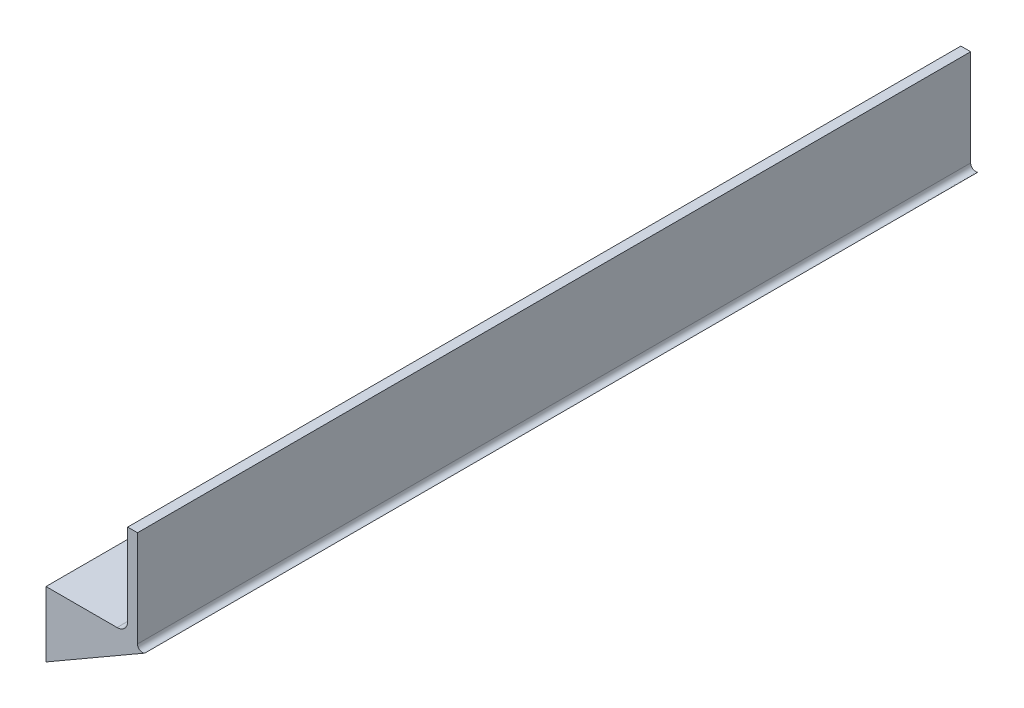
from build123d import *

# Parameters (mm, degrees)
SALIENTE_EXTRUIR1_DEPTH = 255
CROQUIS4_W              = 1.329700855
CROQUIS4_H              = 7.408333333
CROQUIS4_W_2            = 1.329700854
CORTAR_EXTRUIR1_DEPTH   = 1
CROQUIS3_R              = 3
CORTAR_EXTRUIR2_DEPTH   = 4


with BuildPart() as part:
    # Croquis2 → Saliente-Extruir1 (new body)
    with BuildSketch(Plane.XY):
        with BuildLine():
            Line((0, 0), (21.75, 0))
            ThreePointArc((21.75, 0), (24.048097039, 0.951902961), (25, 3.25))
            Line((25, 3.25), (25, 28.25))
            Line((25, 28.25), (28, 28.25))
            Line((28, 28.25), (28, -1.236116251))
            ThreePointArc((28, -1.236116251), (28.75, -2.535154357), (30.25, -2.535154357))
            Line((30.25, -2.535154357), (28, -3.834192463))
            Line((28, -3.834192463), (0, -20))
            Line((0, -20), (0, 0))
        make_face()
    extrude(amount=SALIENTE_EXTRUIR1_DEPTH)

    # Croquis4 → Cortar-Extruir1 (cut)
    # profile 1 of 10: a face of its own
    with BuildSketch(Plane.ZY):
        with BuildLine():
            Line((100.85849359, -13), (100.85849359, -5.591666667))
            Line((100.85849359, -5.591666667), (102.045726496, -5.591666667))
            add(Edge.make_bspline(
                [(102.045726496, -5.591666667), (102.128840223, -5.591657181), (102.289663708, -5.591638827), (102.521690027, -5.59978683), (102.736874843, -5.610327184), (102.934533353, -5.622119389), (103.115001988, -5.642439715), (103.278006314, -5.663855118), (103.423872015, -5.689680775), (103.514052852, -5.712847189), (103.556480369, -5.723746327)],
                knots=[0, 0, 0, 0, 1.311965854, 2.538629056, 3.664479157, 4.713267157, 5.663616078, 6.530575999, 7.308677837, 8, 8, 8, 8], degree=3))
            add(Edge.make_bspline(
                [(103.556480369, -5.723746327), (103.612192006, -5.739119756), (103.721516122, -5.769287359), (103.878103145, -5.830212136), (104.026647779, -5.897934346), (104.166968655, -5.975192721), (104.298204147, -6.062919987), (104.419855516, -6.161812373), (104.534546479, -6.267900344), (104.638204624, -6.38414054), (104.731894509, -6.50696984), (104.81329422, -6.636356059), (104.884020136, -6.770320797), (104.940619395, -6.910549911), (104.983265873, -7.056397608), (105.014457329, -7.207241096), (105.034673616, -7.363557681), (105.03658379, -7.469904963), (105.037553419, -7.523888221)],
                knots=[0, 0, 0, 0, 1.099996261, 2.158545794, 3.195537121, 4.207578794, 5.205712374, 6.197378256, 7.190519799, 8.17788031, 9.159561366, 10.129234751, 11.085776129, 12.040971148, 13.00380137, 13.975669004, 14.972423361, 16, 16, 16, 16], degree=3))
            add(Edge.make_bspline(
                [(105.037553419, -7.523888221), (105.035018127, -7.593242538), (105.030027716, -7.729757989), (104.998148633, -7.930274489), (104.938370385, -8.119791401), (104.860152002, -8.301801453), (104.753799454, -8.475625744), (104.618752288, -8.641181627), (104.457197825, -8.803566814), (104.333276633, -8.900905781), (104.268820112, -8.951535791)],
                knots=[0, 0, 0, 0, 0.986156485, 1.941127874, 2.875419072, 3.804401753, 4.751181392, 5.761612777, 6.835722519, 8, 8, 8, 8], degree=3))
            add(Edge.make_bspline(
                [(104.268820112, -8.951535791), (104.321052585, -8.978200015), (104.423466012, -9.030481181), (104.568862991, -9.116415812), (104.703484723, -9.207818191), (104.82793481, -9.302849265), (104.939602769, -9.405537539), (105.043099558, -9.509965974), (105.133319182, -9.622117885), (105.213996289, -9.737995964), (105.28411952, -9.859278139), (105.345189121, -9.985759592), (105.396772422, -10.117872411), (105.440454496, -10.254944249), (105.473032598, -10.397446568), (105.494274213, -10.545430335), (105.510538122, -10.698390847), (105.511803301, -10.802583729), (105.512446581, -10.855560564)],
                knots=[0, 0, 0, 0, 1.164658916, 2.283573913, 3.35186032, 4.395461096, 5.390182219, 6.362969632, 7.312859996, 8.245001507, 9.165155236, 10.092416118, 11.032087915, 11.979892451, 12.947605196, 13.931445124, 14.948243989, 16, 16, 16, 16], degree=3))
            add(Edge.make_bspline(
                [(105.512446581, -10.855560564), (105.508272124, -10.956743289), (105.50003385, -11.156426991), (105.439799611, -11.449608526), (105.33537258, -11.727571212), (105.195148611, -11.989210308), (105.022365701, -12.226951791), (104.823714904, -12.435211265), (104.601196177, -12.611498287), (104.395895756, -12.730478351), (104.218327059, -12.8103251), (104.071250226, -12.859691396), (103.913292824, -12.905424257), (103.741561454, -12.937538817), (103.55916937, -12.966933593), (103.36433824, -12.985082537), (103.157432198, -12.997381629), (103.015320185, -12.999109564), (102.94208734, -13)],
                knots=[0, 0, 0, 0, 1.284142165, 2.534249414, 3.780121997, 5.041676246, 6.291546858, 7.49970053, 8.684500223, 9.883330709, 10.50184324, 11.153274765, 11.851151195, 12.587658647, 13.369265475, 14.195992086, 15.070362669, 16, 16, 16, 16], degree=3))
            Line((102.94208734, -13), (100.85849359, -13))
        make_face()
        with BuildLine():
            Line((102.188194444, -6.921367521), (102.188194444, -8.536004274))
            Line((102.188194444, -8.536004274), (102.541396234, -8.536004274))
            add(Edge.make_bspline(
                [(102.541396234, -8.536004274), (102.589399531, -8.535585667), (102.682066989, -8.534777571), (102.815915304, -8.524369584), (102.940372622, -8.506612912), (103.054966901, -8.481837888), (103.160765631, -8.450377219), (103.257092937, -8.412523259), (103.343525287, -8.366337313), (103.443939687, -8.297541309), (103.550084949, -8.196304908), (103.643523429, -8.050047952), (103.69855807, -7.88185301), (103.704687444, -7.763228913), (103.707852564, -7.701973157)],
                knots=[0, 0, 0, 0, 1.065314748, 2.056525647, 2.977365736, 3.853934255, 4.656397591, 5.425096493, 6.14721249, 6.826394842, 8.123232004, 9.372140726, 10.643011755, 12, 12, 12, 12], degree=3))
            add(Edge.make_bspline(
                [(103.707852564, -7.701973157), (103.705319889, -7.644596964), (103.700423063, -7.533662402), (103.645010256, -7.377900396), (103.558943211, -7.23986338), (103.457328967, -7.145388332), (103.361639411, -7.080864659), (103.279704142, -7.038378568), (103.189774031, -7.000345453), (103.090108128, -6.971264407), (102.98127558, -6.949443014), (102.863805048, -6.933417814), (102.737493853, -6.922510381), (102.650250443, -6.921756646), (102.605210003, -6.921367521)],
                knots=[0, 0, 0, 0, 1.347982417, 2.606269829, 3.849316587, 5.153353503, 5.842674298, 6.568177932, 7.326619318, 8.142485038, 9.012069166, 9.942760135, 10.937925643, 12, 12, 12, 12], degree=3))
            Line((102.605210003, -6.921367521), (102.188194444, -6.921367521))
        make_face(mode=Mode.SUBTRACT)
        with BuildLine():
            Line((102.188194444, -9.770726496), (102.188194444, -11.670299145))
            Line((102.188194444, -11.670299145), (102.571077057, -11.670299145))
            add(Edge.make_bspline(
                [(102.571077057, -11.670299145), (102.646773437, -11.669866695), (102.792309173, -11.669035254), (103.000788857, -11.658989479), (103.19034901, -11.640883739), (103.360487368, -11.618280181), (103.511464532, -11.587655895), (103.642770161, -11.54872104), (103.756204943, -11.505885918), (103.851088717, -11.452979457), (103.928603325, -11.391409456), (103.998552131, -11.328483436), (104.055584029, -11.255892327), (104.100708731, -11.176752263), (104.139764081, -11.093029143), (104.16331951, -11.001453606), (104.181253787, -10.904739734), (104.182240758, -10.83784484), (104.182745726, -10.803619124)],
                knots=[0, 0, 0, 0, 1.753078804, 3.370512758, 4.83203934, 6.162291463, 7.344201807, 8.395507345, 9.331626367, 10.147333109, 10.898971645, 11.62040215, 12.321813352, 13.025280112, 13.727906689, 14.453419512, 15.208716525, 16, 16, 16, 16], degree=3))
            add(Edge.make_bspline(
                [(104.182745726, -10.803619124), (104.181632127, -10.76448148), (104.179463133, -10.688251877), (104.161748941, -10.576834177), (104.129556466, -10.472818362), (104.089008472, -10.373544607), (104.032583786, -10.282567258), (103.965524974, -10.196737933), (103.88450081, -10.118963079), (103.793384411, -10.044538582), (103.687106153, -9.979375903), (103.565616173, -9.922835737), (103.428254471, -9.875615472), (103.274595554, -9.838018666), (103.105313053, -9.806110777), (102.919171389, -9.787058244), (102.717720816, -9.772888039), (102.578031711, -9.771463382), (102.505779247, -9.770726496)],
                knots=[0, 0, 0, 0, 0.845221588, 1.646264278, 2.427170338, 3.19324141, 3.95557735, 4.731569926, 5.540061037, 6.376114724, 7.268642756, 8.224665384, 9.265483498, 10.400594375, 11.639216012, 12.983232105, 14.439614077, 16, 16, 16, 16], degree=3))
            Line((102.505779247, -9.770726496), (102.188194444, -9.770726496))
        make_face(mode=Mode.SUBTRACT)
    # profile 2 of 10: a face of its own
    with BuildSketch(Plane.ZY):
        with Locations((107.317040599, -9.295833333)):
            Rectangle(CROQUIS4_W, CROQUIS4_H)
    # profile 3 of 10: a face of its own
    with BuildSketch(Plane.ZY):
        with BuildLine():
            add(Edge.make_bspline(
                [(113.173066907, -5.401709402), (113.301869861, -5.405044341), (113.556156067, -5.411628266), (113.930119312, -5.466510421), (114.290502045, -5.555933025), (114.637141301, -5.680236913), (114.969169134, -5.842788864), (115.28775672, -6.038980426), (115.591762891, -6.272514595), (115.878072437, -6.537943406), (116.142674094, -6.826585648), (116.371951585, -7.137360338), (116.567471018, -7.462214992), (116.729518047, -7.802020066), (116.852947021, -8.159128874), (116.939562238, -8.531720633), (116.995208223, -8.919689343), (117.001608368, -9.183843154), (117.004861111, -9.31809395)],
                knots=[0, 0, 0, 0, 1.014329547, 2.002516266, 2.970391464, 3.935626869, 4.897733899, 5.877609409, 6.878433252, 7.912639331, 8.949961323, 9.958554974, 10.949718813, 11.932905612, 12.9188844, 13.919928257, 14.942845884, 16, 16, 16, 16], degree=3))
            add(Edge.make_bspline(
                [(117.004861111, -9.31809395), (117.00139708, -9.450832051), (116.994571097, -9.712396736), (116.941833951, -10.096790161), (116.853760123, -10.465390686), (116.732424601, -10.819032645), (116.573316492, -11.156003118), (116.381609901, -11.478453615), (116.152246055, -11.783391718), (115.893590755, -12.070653786), (115.608833716, -12.331405752), (115.307230808, -12.561192972), (114.990174645, -12.755905991), (114.658129297, -12.91545562), (114.31038271, -13.039276211), (113.947793858, -13.126640636), (113.57038518, -13.17973376), (113.313728976, -13.186515157), (113.183455195, -13.189957265)],
                knots=[0, 0, 0, 0, 1.051557043, 2.072126891, 3.067553643, 4.050577992, 5.02905126, 6.015227836, 7.017913613, 8.04756643, 9.074058332, 10.072836633, 11.047628519, 12.017157415, 12.98668631, 13.966869689, 14.968021931, 16, 16, 16, 16], degree=3))
            add(Edge.make_bspline(
                [(113.183455195, -13.189957265), (113.04720444, -13.186869525), (112.779490331, -13.180802538), (112.387689534, -13.12310826), (112.012310516, -13.036200522), (111.656506677, -12.906495387), (111.316654459, -12.744353061), (110.995250856, -12.544665066), (110.69240388, -12.307761401), (110.409850712, -12.039709257), (110.153856858, -11.746401419), (109.927892068, -11.436547699), (109.737285755, -11.112515106), (109.582030946, -10.774151986), (109.45963429, -10.423561183), (109.373297357, -10.058607499), (109.32229607, -9.680166225), (109.315191887, -9.423121347), (109.31159188, -9.292865251)],
                knots=[0, 0, 0, 0, 1.067978421, 2.098431617, 3.099715153, 4.085208694, 5.062210972, 6.048429807, 7.046490867, 8.072918869, 9.098532598, 10.095778865, 11.076610158, 12.041847152, 13.011192615, 13.984257998, 14.978533688, 16, 16, 16, 16], degree=3))
            add(Edge.make_bspline(
                [(109.31159188, -9.292865251), (109.31272177, -9.205235769), (109.314967241, -9.031086394), (109.342016313, -8.77300591), (109.3809592, -8.519962811), (109.438553881, -8.272965982), (109.508516699, -8.030272977), (109.599163412, -7.794142842), (109.702343903, -7.562053058), (109.822900591, -7.336744895), (109.956947972, -7.120291377), (110.103205599, -6.913713554), (110.262041235, -6.719509252), (110.432943218, -6.536402241), (110.616500499, -6.365596098), (110.810298572, -6.204672822), (111.018095991, -6.057907109), (111.235344722, -5.921714647), (111.460819968, -5.798558166), (111.693603838, -5.693731052), (111.928900527, -5.60218732), (112.169853279, -5.529936958), (112.413879859, -5.471089794), (112.663587195, -5.432173155), (112.916719323, -5.405124832), (113.087414924, -5.40285058), (113.173066907, -5.401709402)],
                knots=[0, 0, 0, 0, 1.034744296, 2.056386356, 3.06226378, 4.057406941, 5.050368692, 6.043467995, 7.042652155, 8.049140477, 9.059438543, 10.048523776, 11.036952808, 12.020949711, 13.004946614, 13.997082645, 14.994316842, 16.007702937, 17.024872941, 18.026463647, 19.021641123, 20.005082605, 20.995858141, 21.984425357, 22.988620895, 24, 24, 24, 24], degree=3))
        make_face()
        with BuildLine():
            add(Edge.make_bspline(
                [(113.152290331, -6.731410256), (113.06560596, -6.733736193), (112.894525699, -6.73832666), (112.643582113, -6.773299814), (112.402667408, -6.829155916), (112.17311707, -6.910062797), (111.953936207, -7.013036722), (111.744736281, -7.137717888), (111.548414277, -7.28839207), (111.362352431, -7.456970244), (111.19427617, -7.644805071), (111.045775491, -7.846102034), (110.921504342, -8.060524968), (110.817426476, -8.286081936), (110.73907891, -8.525309267), (110.683274287, -8.776333066), (110.648007849, -9.03958586), (110.643562471, -9.219044948), (110.641292735, -9.310673745)],
                knots=[0, 0, 0, 0, 1.033739768, 2.040188636, 3.016340934, 3.979330865, 4.937572243, 5.900995986, 6.878200029, 7.884839167, 8.891893314, 9.879764717, 10.863503415, 11.843163062, 12.837761627, 13.859916423, 14.907309254, 16, 16, 16, 16], degree=3))
            add(Edge.make_bspline(
                [(110.641292735, -9.310673745), (110.644302058, -9.412219063), (110.650199832, -9.611231063), (110.691697288, -9.901544406), (110.762695305, -10.175716545), (110.86521506, -10.432406545), (110.992366453, -10.674464756), (111.150268304, -10.898924411), (111.336363348, -11.107129469), (111.479729463, -11.228688254), (111.55249399, -11.290384615)],
                knots=[0, 0, 0, 0, 1.078454662, 2.113592447, 3.107694534, 4.079536787, 5.043276885, 6.005368276, 6.987637804, 8, 8, 8, 8], degree=3))
            add(Edge.make_bspline(
                [(111.55249399, -11.290384615), (111.61210203, -11.335963517), (111.72997513, -11.42609442), (111.91812626, -11.541615663), (112.111884876, -11.640628892), (112.312713128, -11.720630409), (112.520186879, -11.783558258), (112.734277676, -11.827625596), (112.954682172, -11.855281661), (113.103730021, -11.858587085), (113.179003072, -11.86025641)],
                knots=[0, 0, 0, 0, 1.023928204, 2.024787132, 3.009472467, 3.9914905, 4.972207045, 5.96565515, 6.972602802, 8, 8, 8, 8], degree=3))
            add(Edge.make_bspline(
                [(113.179003072, -11.86025641), (113.264196903, -11.857910753), (113.431818446, -11.853295597), (113.678090581, -11.818752982), (113.914026768, -11.760294406), (114.141091716, -11.680097269), (114.358630672, -11.575830417), (114.565580464, -11.447282032), (114.762303932, -11.296030524), (114.948128737, -11.125238549), (115.117981393, -10.936663782), (115.266172182, -10.734293123), (115.394394533, -10.522585402), (115.496308098, -10.298544219), (115.577751, -10.064284416), (115.632883984, -9.818768507), (115.668448344, -9.563008603), (115.672894975, -9.38895495), (115.675160256, -9.300285457)],
                knots=[0, 0, 0, 0, 1.026359118, 2.019393844, 2.989460624, 3.950973911, 4.916101784, 5.890408035, 6.881132271, 7.902007068, 8.92769091, 9.933912415, 10.920395702, 11.90457117, 12.894218921, 13.903490204, 14.931958862, 16, 16, 16, 16], degree=3))
            add(Edge.make_bspline(
                [(115.675160256, -9.300285457), (115.672816596, -9.212125837), (115.668203458, -9.038597072), (115.633600046, -8.783494725), (115.575512198, -8.539062697), (115.495074238, -8.304901805), (115.392359222, -8.080782485), (115.265341684, -7.867492873), (115.114467313, -7.665239167), (114.943208474, -7.475399649), (114.756803754, -7.300949292), (114.556679661, -7.149558094), (114.348435893, -7.018003957), (114.127294321, -6.914949757), (113.897779317, -6.832846696), (113.658490368, -6.772384823), (113.408521152, -6.738572348), (113.238461927, -6.733818901), (113.152290331, -6.731410256)],
                knots=[0, 0, 0, 0, 1.055025985, 2.07665775, 3.074803781, 4.057872707, 5.035505728, 6.020516407, 7.023567878, 8.050795229, 9.077271434, 10.074415901, 11.050397877, 12.019801805, 12.988065821, 13.964604439, 14.968634123, 16, 16, 16, 16], degree=3))
        make_face(mode=Mode.SUBTRACT)
    # profile 4 of 10: a face of its own
    with BuildSketch(Plane.ZY):
        with BuildLine():
            Line((118.334561966, -13), (118.334561966, -5.591666667))
            Line((118.334561966, -5.591666667), (119.521794872, -5.591666667))
            add(Edge.make_bspline(
                [(119.521794872, -5.591666667), (119.604908599, -5.591657181), (119.765732084, -5.591638827), (119.997758403, -5.59978683), (120.212943219, -5.610327184), (120.410601729, -5.622119389), (120.591070364, -5.642439715), (120.75407469, -5.663855118), (120.899940391, -5.689680775), (120.990121228, -5.712847189), (121.032548745, -5.723746327)],
                knots=[0, 0, 0, 0, 1.311965854, 2.538629056, 3.664479157, 4.713267157, 5.663616078, 6.530575999, 7.308677837, 8, 8, 8, 8], degree=3))
            add(Edge.make_bspline(
                [(121.032548745, -5.723746327), (121.088260382, -5.739119756), (121.197584498, -5.769287359), (121.354171521, -5.830212136), (121.502716155, -5.897934346), (121.643037031, -5.975192721), (121.774272523, -6.062919987), (121.895923892, -6.161812373), (122.010614856, -6.267900344), (122.114273001, -6.38414054), (122.207962885, -6.50696984), (122.289362596, -6.636356059), (122.360088512, -6.770320797), (122.416687771, -6.910549911), (122.459334249, -7.056397608), (122.490525705, -7.207241096), (122.510741992, -7.363557681), (122.512652166, -7.469904963), (122.513621795, -7.523888221)],
                knots=[0, 0, 0, 0, 1.099996261, 2.158545794, 3.195537121, 4.207578794, 5.205712374, 6.197378256, 7.190519799, 8.17788031, 9.159561366, 10.129234751, 11.085776129, 12.040971148, 13.00380137, 13.975669004, 14.972423361, 16, 16, 16, 16], degree=3))
            add(Edge.make_bspline(
                [(122.513621795, -7.523888221), (122.511086503, -7.593242538), (122.506096092, -7.729757989), (122.474217009, -7.930274489), (122.414438761, -8.119791401), (122.336220378, -8.301801453), (122.22986783, -8.475625744), (122.094820664, -8.641181627), (121.933266201, -8.803566814), (121.809345009, -8.900905781), (121.744888488, -8.951535791)],
                knots=[0, 0, 0, 0, 0.986156485, 1.941127874, 2.875419072, 3.804401753, 4.751181392, 5.761612777, 6.835722519, 8, 8, 8, 8], degree=3))
            add(Edge.make_bspline(
                [(121.744888488, -8.951535791), (121.797120961, -8.978200015), (121.899534388, -9.030481181), (122.044931367, -9.116415812), (122.179553099, -9.207818191), (122.304003186, -9.302849265), (122.415671145, -9.405537539), (122.519167934, -9.509965974), (122.609387558, -9.622117885), (122.690064665, -9.737995964), (122.760187896, -9.859278139), (122.821257497, -9.985759592), (122.872840798, -10.117872411), (122.916522872, -10.254944249), (122.949100974, -10.397446568), (122.97034259, -10.545430335), (122.986606498, -10.698390847), (122.987871677, -10.802583729), (122.988514957, -10.855560564)],
                knots=[0, 0, 0, 0, 1.164658916, 2.283573913, 3.35186032, 4.395461096, 5.390182219, 6.362969632, 7.312859996, 8.245001507, 9.165155236, 10.092416118, 11.032087915, 11.979892451, 12.947605196, 13.931445124, 14.948243989, 16, 16, 16, 16], degree=3))
            add(Edge.make_bspline(
                [(122.988514957, -10.855560564), (122.9843405, -10.956743289), (122.976102226, -11.156426991), (122.915867987, -11.449608526), (122.811440956, -11.727571212), (122.671216987, -11.989210308), (122.498434078, -12.226951791), (122.29978328, -12.435211265), (122.077264553, -12.611498287), (121.871964132, -12.730478351), (121.694395435, -12.8103251), (121.547318602, -12.859691396), (121.3893612, -12.905424257), (121.21762983, -12.937538817), (121.035237747, -12.966933593), (120.840406616, -12.985082537), (120.633500575, -12.997381629), (120.491388561, -12.999109564), (120.418155716, -13)],
                knots=[0, 0, 0, 0, 1.284142165, 2.534249414, 3.780121997, 5.041676246, 6.291546858, 7.49970053, 8.684500223, 9.883330709, 10.50184324, 11.153274765, 11.851151195, 12.587658647, 13.369265475, 14.195992086, 15.070362669, 16, 16, 16, 16], degree=3))
            Line((120.418155716, -13), (118.334561966, -13))
        make_face()
        with BuildLine():
            Line((119.664262821, -6.921367521), (119.664262821, -8.536004274))
            Line((119.664262821, -8.536004274), (120.01746461, -8.536004274))
            add(Edge.make_bspline(
                [(120.01746461, -8.536004274), (120.065467907, -8.535585667), (120.158135365, -8.534777571), (120.29198368, -8.524369584), (120.416440998, -8.506612912), (120.531035277, -8.481837888), (120.636834007, -8.450377219), (120.733161313, -8.412523259), (120.819593663, -8.366337313), (120.920008063, -8.297541309), (121.026153325, -8.196304908), (121.119591805, -8.050047952), (121.174626446, -7.88185301), (121.18075582, -7.763228913), (121.18392094, -7.701973157)],
                knots=[0, 0, 0, 0, 1.065314748, 2.056525647, 2.977365736, 3.853934255, 4.656397591, 5.425096493, 6.14721249, 6.826394842, 8.123232004, 9.372140726, 10.643011755, 12, 12, 12, 12], degree=3))
            add(Edge.make_bspline(
                [(121.18392094, -7.701973157), (121.181388265, -7.644596964), (121.176491439, -7.533662402), (121.121078632, -7.377900396), (121.035011587, -7.23986338), (120.933397343, -7.145388332), (120.837707787, -7.080864659), (120.755772518, -7.038378568), (120.665842407, -7.000345453), (120.566176504, -6.971264407), (120.457343956, -6.949443014), (120.339873424, -6.933417814), (120.21356223, -6.922510381), (120.126318819, -6.921756646), (120.081278379, -6.921367521)],
                knots=[0, 0, 0, 0, 1.347982417, 2.606269829, 3.849316587, 5.153353503, 5.842674298, 6.568177932, 7.326619318, 8.142485038, 9.012069166, 9.942760135, 10.937925643, 12, 12, 12, 12], degree=3))
            Line((120.081278379, -6.921367521), (119.664262821, -6.921367521))
        make_face(mode=Mode.SUBTRACT)
        with BuildLine():
            Line((119.664262821, -9.770726496), (119.664262821, -11.670299145))
            Line((119.664262821, -11.670299145), (120.047145433, -11.670299145))
            add(Edge.make_bspline(
                [(120.047145433, -11.670299145), (120.122841813, -11.669866695), (120.268377549, -11.669035254), (120.476857233, -11.658989479), (120.666417386, -11.640883739), (120.836555744, -11.618280181), (120.987532908, -11.587655895), (121.118838537, -11.54872104), (121.232273319, -11.505885918), (121.327157093, -11.452979457), (121.404671701, -11.391409456), (121.474620507, -11.328483436), (121.531652405, -11.255892327), (121.576777107, -11.176752263), (121.615832457, -11.093029143), (121.639387886, -11.001453606), (121.657322163, -10.904739734), (121.658309134, -10.83784484), (121.658814103, -10.803619124)],
                knots=[0, 0, 0, 0, 1.753078804, 3.370512758, 4.83203934, 6.162291463, 7.344201807, 8.395507345, 9.331626367, 10.147333109, 10.898971645, 11.62040215, 12.321813352, 13.025280112, 13.727906689, 14.453419512, 15.208716525, 16, 16, 16, 16], degree=3))
            add(Edge.make_bspline(
                [(121.658814103, -10.803619124), (121.657700503, -10.76448148), (121.65553151, -10.688251877), (121.637817317, -10.576834177), (121.605624842, -10.472818362), (121.565076849, -10.373544607), (121.508652162, -10.282567258), (121.44159335, -10.196737933), (121.360569186, -10.118963079), (121.269452787, -10.044538582), (121.163174529, -9.979375903), (121.041684549, -9.922835737), (120.904322847, -9.875615472), (120.75066393, -9.838018666), (120.581381429, -9.806110777), (120.395239765, -9.787058244), (120.193789192, -9.772888039), (120.054100087, -9.771463382), (119.981847623, -9.770726496)],
                knots=[0, 0, 0, 0, 0.845221588, 1.646264278, 2.427170338, 3.19324141, 3.95557735, 4.731569926, 5.540061037, 6.376114724, 7.268642756, 8.224665384, 9.265483498, 10.400594375, 11.639216012, 12.983232105, 14.439614077, 16, 16, 16, 16], degree=3))
            Line((119.981847623, -9.770726496), (119.664262821, -9.770726496))
        make_face(mode=Mode.SUBTRACT)
    # profile 5 of 10: a face of its own
    with BuildSketch(Plane.ZY):
        with Locations((124.793108975, -9.295833333)):
            Rectangle(CROQUIS4_W, CROQUIS4_H)
    # profile 6 of 10: a face of its own
    with BuildSketch(Plane.ZY):
        Polygon((126.787660256, -5.591666667), (131.251655983, -5.591666667), (128.598190438, -11.670299145), (131.061698718, -11.670299145), (131.061698718, -13), (126.597702991, -13), (129.252652577, -6.921367521), (126.787660256, -6.921367521), align=None)
    # profile 7 of 10: a face of its own
    with BuildSketch(Plane.ZY):
        Polygon((132.29642094, -5.591666667), (133.626121795, -5.591666667), (133.626121795, -8.199126936), (135.727524038, -5.591666667), (137.405974559, -5.591666667), (134.765865385, -8.868429487), (137.662713675, -13), (136.061433293, -13), (133.626121795, -9.525859709), (133.626121795, -13), (132.29642094, -13), align=None)
    # profile 8 of 10: a face of its own
    with BuildSketch(Plane.ZY):
        Polygon((140.940960537, -5.591666667), (142.174198718, -5.591666667), (145.166025641, -13), (143.745798277, -13), (143.169990318, -11.48034188), (139.942200855, -11.48034188), (139.366392895, -13), (137.947649573, -13), align=None)
        Polygon((141.556837607, -7.578797743), (140.44677484, -10.150641026), (142.666900374, -10.150641026), align=None, mode=Mode.SUBTRACT)
    # profile 9 of 10: a face of its own
    with BuildSketch(Plane.ZY):
        with Locations((146.733173077, -9.295833333)):
            Rectangle(CROQUIS4_W_2, CROQUIS4_H)
    # profile 10 of 10: a face of its own
    with BuildSketch(Plane.ZY):
        Polygon((151.38861011, -5.591666667), (152.621848291, -5.591666667), (155.613675214, -13), (154.19344785, -13), (153.61763989, -11.48034188), (150.389850427, -11.48034188), (149.814042468, -13), (148.395299145, -13), align=None)
        Polygon((152.004487179, -7.578797743), (150.894424412, -10.150641026), (153.114549947, -10.150641026), align=None, mode=Mode.SUBTRACT)
    extrude(amount=-CORTAR_EXTRUIR1_DEPTH, mode=Mode.SUBTRACT)

    # Croquis3 → Cortar-Extruir2 (cut)
    with BuildSketch(Plane(origin=(0, 0, 0), x_dir=(1, 0, 0), z_dir=(0, 1, 0))):
        with Locations(Location((14.75, -198.5, 0), (0, 0, 270))):
            Circle(CROQUIS3_R)
        with Locations(Location((14.75, -56.5, 0), (0, 0, 270))):
            Circle(CROQUIS3_R)
    extrude(amount=-CORTAR_EXTRUIR2_DEPTH, mode=Mode.SUBTRACT)


solid = part.part
